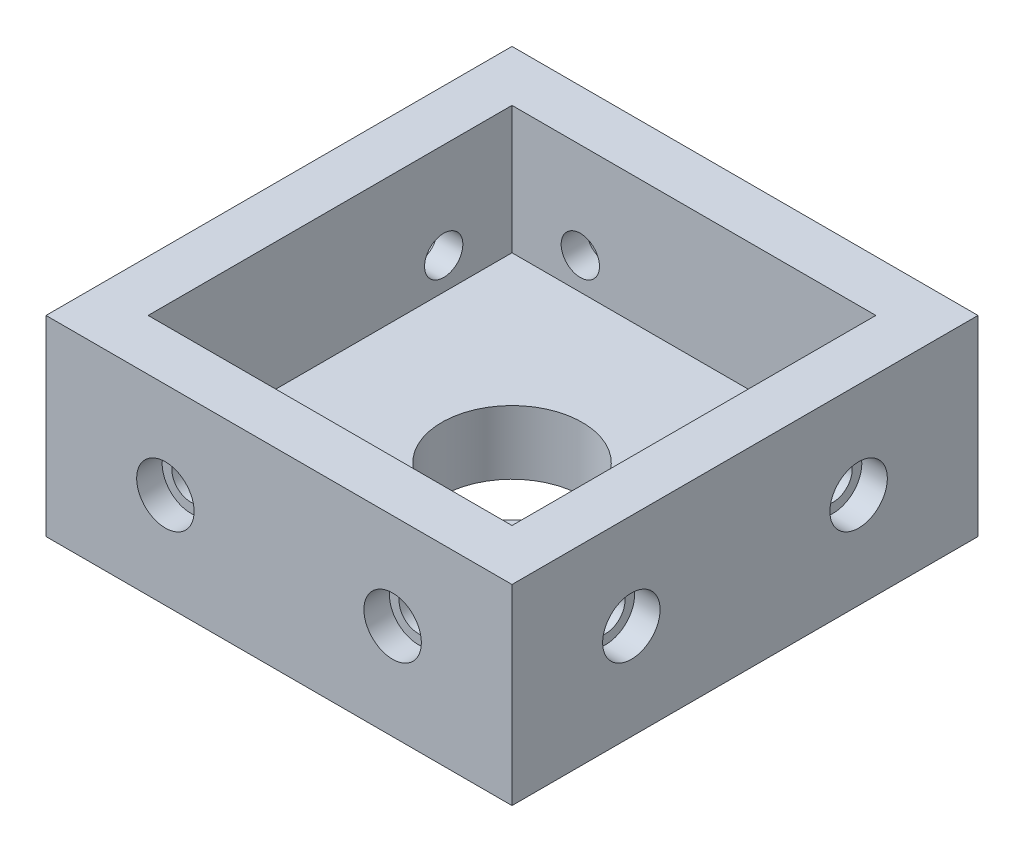
from build123d import *

# Parameters (mm, degrees)
SKETCH_1_W           = 36.5
SKETCH_1_H           = 36.5
SKETCH_1_R           = 5.5
EXTRUDE_1_DEPTH      = 5
EXTRUDE_START        = 5
SKETCH_1_18_W        = 36.5
SKETCH_1_18_H        = 36.5
SKETCH_1_18_W_2      = 28.5
SKETCH_1_18_H_2      = 28.5
EXTRUDE_2_DEPTH      = 10
SKETCH_2_R           = 1.5
CUT_EXTRUDE_1_DEPTH  = 52.122402134
SKETCH_2_3_R         = 2.25
CUT_EXTRUDE_2_DEPTH  = 2
CUT_EXTRUDE_START    = -34.5
SKETCH_2_4_R         = 2.25
SKETCH_2_4_R_2       = 1.5
CUT_EXTRUDE_3_DEPTH  = 2
SKETCH_3_R           = 1.5
CUT_EXTRUDE_4_DEPTH  = 44.477724181
SKETCH_3_4_R         = 2.25
CUT_EXTRUDE_8_DEPTH  = 2
SKETCH_3_5_R         = 2.25
CUT_EXTRUDE_9_DEPTH  = 2
EXTRUDE_START_2      = 6
SKETCH_4_W           = 32.5
SKETCH_4_H           = 22
SKETCH_4_R           = 5.5
EXTRUDE_3_DEPTH      = 6
EXTRUDE_START_3      = 14
SKETCH_4_3_W         = 32.5
SKETCH_4_3_H         = 22
EXTRUDE_4_DEPTH      = 8
CUT_EXTRUDE_START_2  = 6
SKETCH_4_4_R         = 1
CUT_EXTRUDE_10_DEPTH = 5
EXTRUDE_5_DEPTH      = 2
SKETCH_4_6_R         = 0.75
CUT_EXTRUDE_11_DEPTH = 4
CUT_EXTRUDE_12_REACH = 48.24
SKETCH_4_7_R         = 1.5
SKETCH_5_W           = 200
SKETCH_5_H           = 100
CUT_EXTRUDE_13_DEPTH = 47.239863754


with BuildPart() as part:
    # 草图1 → 凸台-拉伸1 (new body)
    with BuildSketch(Plane(origin=(0, 0, 0), x_dir=(1, 0, 0), z_dir=(0, 1, 0))):
        with Locations((14.25, 0)):
            Rectangle(SKETCH_1_W, SKETCH_1_H)
        with Locations(Location((14.25, 0, 0), (0, 0, 270))):
            Circle(SKETCH_1_R, mode=Mode.SUBTRACT)
    extrude(amount=EXTRUDE_1_DEPTH)

    # 草图1<18> → 凸台-拉伸2 (add)
    with BuildSketch(Plane(origin=(0, 0, 0), x_dir=(1, 0, 0), z_dir=(0, 1, 0)).offset(EXTRUDE_START)):
        with Locations((14.25, 0)):
            Rectangle(SKETCH_1_18_W, SKETCH_1_18_H)
        with Locations((14.25, 0)):
            Rectangle(SKETCH_1_18_W_2, SKETCH_1_18_H_2, mode=Mode.SUBTRACT)
    extrude(amount=EXTRUDE_2_DEPTH)

    # 草图2 → 切除-拉伸1 (cut, through all)
    with BuildSketch(Plane(origin=(0, 0, -18.25), x_dir=(-1, 0, 0), z_dir=(0, 0, -1))):
        with Locations((-23.15, 7.5)):
            Circle(SKETCH_2_R)
        with Locations((-5.35, 7.5)):
            Circle(SKETCH_2_R)
    extrude(amount=-CUT_EXTRUDE_1_DEPTH, mode=Mode.SUBTRACT)

    # 草图2<3> → 切除-拉伸2 (cut)
    with BuildSketch(Plane(origin=(0, 0, -18.25), x_dir=(-1, 0, 0), z_dir=(0, 0, -1))):
        with Locations((-23.15, 7.5)):
            Circle(SKETCH_2_3_R)
        with Locations((-5.35, 7.5)):
            Circle(SKETCH_2_3_R)
    extrude(amount=-CUT_EXTRUDE_2_DEPTH, mode=Mode.SUBTRACT)

    # 草图2<4> → 切除-拉伸3 (cut)
    # profile 1 of 2: a face of its own
    with BuildSketch(Plane(origin=(0, 0, -18.25), x_dir=(-1, 0, 0), z_dir=(0, 0, -1)).offset(CUT_EXTRUDE_START)):
        with Locations((-23.15, 7.5)):
            Circle(SKETCH_2_4_R)
        with Locations(Location((-23.15, 7.5, 0), (0, 0, 180))):
            Circle(SKETCH_2_4_R_2, mode=Mode.SUBTRACT)
    # profile 2 of 2: a face of its own
    with BuildSketch(Plane(origin=(0, 0, -18.25), x_dir=(-1, 0, 0), z_dir=(0, 0, -1)).offset(CUT_EXTRUDE_START)):
        with Locations((-5.35, 7.5)):
            Circle(SKETCH_2_4_R)
        with Locations(Location((-5.35, 7.5, 0), (0, 0, 180))):
            Circle(SKETCH_2_4_R_2, mode=Mode.SUBTRACT)
    extrude(amount=-CUT_EXTRUDE_3_DEPTH, mode=Mode.SUBTRACT)

    # 草图3 → 切除-拉伸4 (cut, through all)
    with BuildSketch(Plane.ZY.offset(4)):
        with Locations((-8.9, 7.5)):
            Circle(SKETCH_3_R)
        with Locations((8.9, 7.5)):
            Circle(SKETCH_3_R)
    extrude(amount=-CUT_EXTRUDE_4_DEPTH, mode=Mode.SUBTRACT)

    # 草图3<4> → 切除-拉伸8 (cut)
    with BuildSketch(Plane.ZY.offset(4)):
        with Locations((-8.9, 7.5)):
            Circle(SKETCH_3_4_R)
        with Locations((8.9, 7.5)):
            Circle(SKETCH_3_4_R)
    extrude(amount=-CUT_EXTRUDE_8_DEPTH, mode=Mode.SUBTRACT)

    # 草图3<5> → 切除-拉伸9 (cut)
    with BuildSketch(Plane.ZY.offset(4).offset(CUT_EXTRUDE_START)):
        with Locations((-8.9, 7.5)):
            Circle(SKETCH_3_5_R)
        with Locations((8.9, 7.5)):
            Circle(SKETCH_3_5_R)
    extrude(amount=-CUT_EXTRUDE_9_DEPTH, mode=Mode.SUBTRACT)

    # 草图4 → 凸台-拉伸3 (add)
    with BuildSketch(Plane.XZ.offset(EXTRUDE_START_2)):
        with Locations((23.5, 0)):
            Rectangle(SKETCH_4_W, SKETCH_4_H)
        with Locations(Location((14.25, 0, 0), (0, 0, 270))):
            Circle(SKETCH_4_R, mode=Mode.SUBTRACT)
    extrude(amount=-EXTRUDE_3_DEPTH)

    # 草图4<3> → 凸台-拉伸4 (add)
    with BuildSketch(Plane.XZ.offset(EXTRUDE_START_3)):
        with Locations((23.5, 0)):
            Rectangle(SKETCH_4_3_W, SKETCH_4_3_H)
        with BuildLine():
            ThreePointArc((18.067307692, 3.959565883), (27.052586177, 9.998051199), (36.269230769, 4.318967044))
            ThreePointArc((36.269230769, 4.318967044), (38.08567491, 2.490366053), (38.75, 0))
            ThreePointArc((38.75, 0), (38.08567491, -2.490366053), (36.269230769, -4.318967044))
            ThreePointArc((36.269230769, -4.318967044), (27.052586177, -9.998051199), (18.067307692, -3.959565883))
            ThreePointArc((18.067307692, -3.959565883), (8.75, 0), (18.067307692, 3.959565883))
        make_face(mode=Mode.SUBTRACT)
    extrude(amount=-EXTRUDE_4_DEPTH)

    # 草图4<4> → 切除-拉伸10 (cut)
    with BuildSketch(Plane.XZ.offset(CUT_EXTRUDE_START_2)):
        with Locations(Location((27.25, 0, 0), (0, 0, 270))):
            Circle(SKETCH_4_4_R)
    extrude(amount=-CUT_EXTRUDE_10_DEPTH, mode=Mode.SUBTRACT)

    # 草图4<5> → 凸台-拉伸5 (add)
    with BuildSketch(Plane.XZ):
        Polygon((39.75, 11), (39.75, 15.5), (2.75, 15.5), (2.75, -15.5), (39.75, -15.5), (39.75, -11), (7.25, -11), (7.25, 11), align=None)
    extrude(amount=EXTRUDE_5_DEPTH)

    # 草图4<6> → 切除-拉伸11 (cut)
    with BuildSketch(Plane.XZ):
        with Locations(Location((23.5, 13.25, 0), (0, 0, 90))):
            Circle(SKETCH_4_6_R)
        with Locations(Location((5, 0, 0), (0, 0, 90))):
            Circle(SKETCH_4_6_R)
        with Locations(Location((23.5, -13.25, 0), (0, 0, 90))):
            Circle(SKETCH_4_6_R)
    extrude(amount=-CUT_EXTRUDE_11_DEPTH, mode=Mode.SUBTRACT)

    # 草图4<7> → 切除-拉伸12 (cut, up to next)
    with BuildSketch(Plane.XZ, mode=Mode.PRIVATE) as cut_extrude_12_sk1:
        with Locations(Location((23.5, 13.25, 0), (0, 0, 90))):
            Circle(SKETCH_4_7_R)
    cut_extrude_12_tool1 = extrude(cut_extrude_12_sk1.sketch, amount=CUT_EXTRUDE_12_REACH, mode=Mode.PRIVATE) & part.part
    # 草图4<7> → 切除-拉伸12 (cut, up to next)
    with BuildSketch(Plane.XZ, mode=Mode.PRIVATE) as cut_extrude_12_sk2:
        with Locations(Location((5, 0, 0), (0, 0, 90))):
            Circle(SKETCH_4_7_R)
    cut_extrude_12_tool2 = extrude(cut_extrude_12_sk2.sketch, amount=CUT_EXTRUDE_12_REACH, mode=Mode.PRIVATE) & part.part
    # 草图4<7> → 切除-拉伸12 (cut, up to next)
    with BuildSketch(Plane.XZ, mode=Mode.PRIVATE) as cut_extrude_12_sk3:
        with Locations(Location((23.5, -13.25, 0), (0, 0, 90))):
            Circle(SKETCH_4_7_R)
    cut_extrude_12_tool3 = extrude(cut_extrude_12_sk3.sketch, amount=CUT_EXTRUDE_12_REACH, mode=Mode.PRIVATE) & part.part
    add(cut_extrude_12_tool1.solids().sort_by_distance((23.5, 0, 13.25))[0], mode=Mode.SUBTRACT)
    add(cut_extrude_12_tool2.solids().sort_by_distance((5, 0, 0))[0], mode=Mode.SUBTRACT)
    add(cut_extrude_12_tool3.solids().sort_by_distance((23.5, 0, -13.25))[0], mode=Mode.SUBTRACT)

    # 草图5 → 切除-拉伸13 (cut, through all)
    with BuildSketch(Plane.XZ):
        Rectangle(SKETCH_5_W, SKETCH_5_H)
    extrude(amount=CUT_EXTRUDE_13_DEPTH, mode=Mode.SUBTRACT)


solid = part.part
